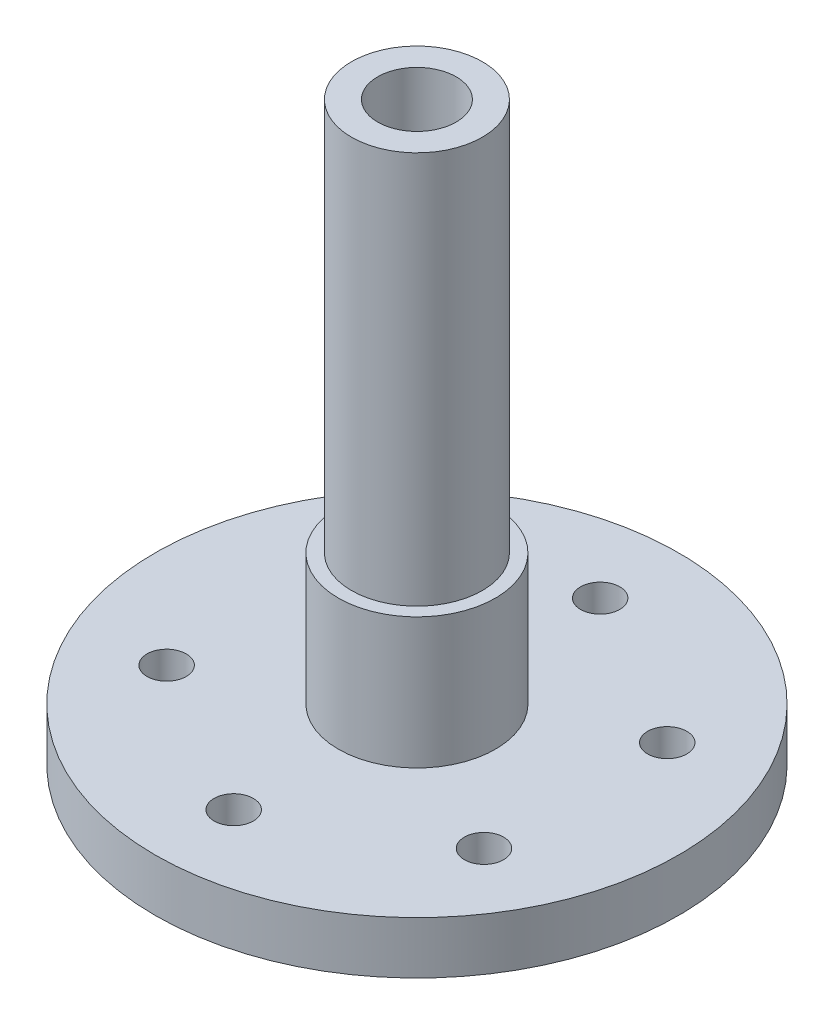
from build123d import *

# Parameters (mm, degrees)
SKETCH_1_R      = 20
SKETCH_1_R_2    = 1.5
SKETCH_1_R_3    = 3
EXTRUDE_1_DEPTH = 4
SKETCH_2_R      = 6
SKETCH_2_R_2    = 3
EXTRUDE_2_DEPTH = 10
SKETCH_3_R      = 5
SKETCH_3_R_2    = 3
EXTRUDE_3_DEPTH = 30


with BuildPart() as part:
    # 草图1 → 凸台-拉伸1 (new body)
    with BuildSketch(Plane(origin=(0, 0, 0), x_dir=(1, 0, 0), z_dir=(0, 1, 0))):
        Circle(SKETCH_1_R)
        with Locations((0, 14)):
            Circle(SKETCH_1_R_2, mode=Mode.SUBTRACT)
        with Locations((12.124355653, 7)):
            Circle(SKETCH_1_R_2, mode=Mode.SUBTRACT)
        with Locations((12.124355653, -7)):
            Circle(SKETCH_1_R_2, mode=Mode.SUBTRACT)
        with Locations((0, -14)):
            Circle(SKETCH_1_R_2, mode=Mode.SUBTRACT)
        with Locations((-12.124355653, -7)):
            Circle(SKETCH_1_R_2, mode=Mode.SUBTRACT)
        with Locations((-12.124355653, 7)):
            Circle(SKETCH_1_R_2, mode=Mode.SUBTRACT)
        Circle(SKETCH_1_R_3, mode=Mode.SUBTRACT)
    extrude(amount=EXTRUDE_1_DEPTH)

    # 草图2 → 凸台-拉伸2 (add)
    with BuildSketch(Plane(origin=(0, 4, 0), x_dir=(1, 0, 0), z_dir=(0, 1, 0))):
        Circle(SKETCH_2_R)
        Circle(SKETCH_2_R_2, mode=Mode.SUBTRACT)
    extrude(amount=EXTRUDE_2_DEPTH)

    # 草图3 → 凸台-拉伸3 (add)
    with BuildSketch(Plane(origin=(0, 14, 0), x_dir=(1, 0, 0), z_dir=(0, 1, 0))):
        Circle(SKETCH_3_R)
        Circle(SKETCH_3_R_2, mode=Mode.SUBTRACT)
    extrude(amount=EXTRUDE_3_DEPTH)


solid = part.part
